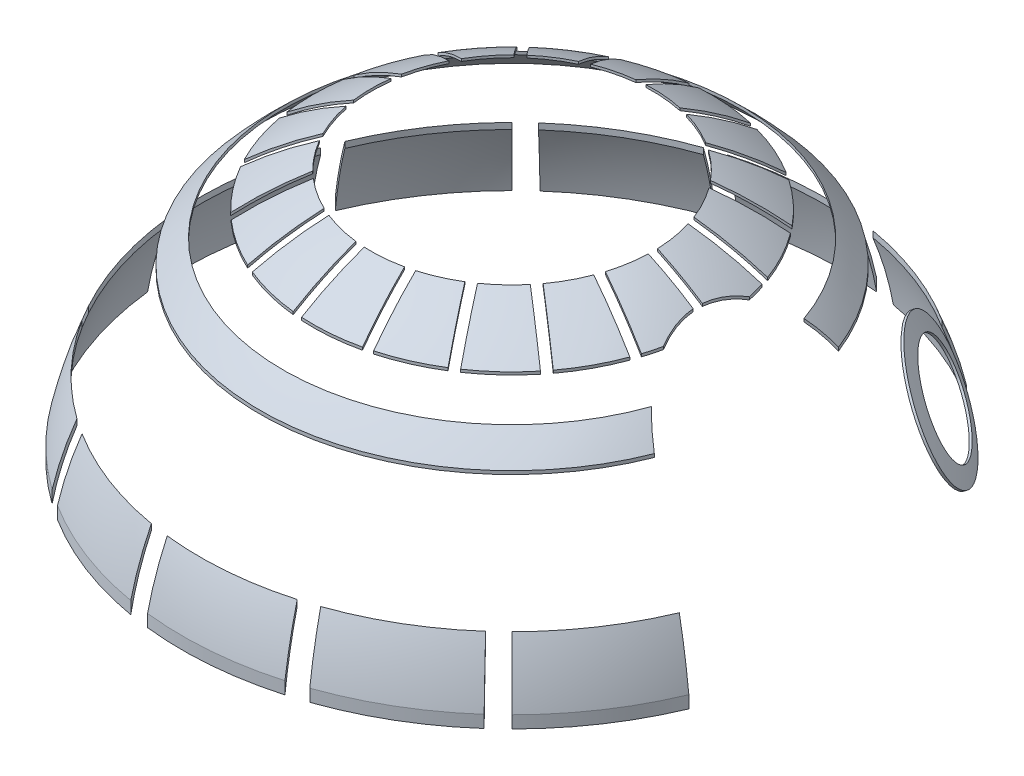
from build123d import *

# Parameters (mm, degrees)
SHELL_1_T           = 0.5
SKETCH_2_OUTSIDE_W  = 198.3
SKETCH_2_OUTSIDE_H  = 198.3
CUT_EXTRUDE_1_DEPTH = 255
SKETCH_4_R          = 15
SKETCH_4_R_2        = 11
CUT_EXTRUDE_2_DEPTH = 20


with BuildPart() as part:
    # 草图1 → 旋转1 (revolve)
    with BuildSketch(Plane.XY):
        with BuildLine():
            Line((-75, 129.232052778), (0, 129.232052778))
            Line((0, 129.232052778), (0, 204.232052778))
            ThreePointArc((0, 204.232052778), (-53.033008589, 182.265061367), (-75, 129.232052778))
        make_face()
    revolve(axis=Axis((0, 0, 0), (0, 1, 0)))

    # 抽壳1
    shell_1_openings = [part.faces().sort_by_distance(p)[0] for p in [
        (0, 129.232052778, 0),
    ]]
    offset(amount=SHELL_1_T, openings=shell_1_openings, kind=Kind.INTERSECTION)

    # 草图2 outside → 切除-拉伸1 (cut)
    with BuildSketch(Plane(origin=(0, 0, 0), x_dir=(1, 0, 0), z_dir=(0, 1, 0))):
        Rectangle(SKETCH_2_OUTSIDE_W, SKETCH_2_OUTSIDE_H)
        with BuildLine():
            Line((64.567988979, -27.036545622), (68.257588349, -28.581491086))
            ThreePointArc((68.257588349, -28.581491086), (61.44952225, -41.230525285), (52.325901808, -52.325901808))
            Line((52.325901808, -52.325901808), (49.497474683, -49.497474683))
            ThreePointArc((49.497474683, -49.497474683), (58.127926453, -39.001848242), (64.567988979, -27.036545622))
        make_face(mode=Mode.SUBTRACT)
        with BuildLine():
            Line((23.561083333, -37.940390341), (16.433673676, -27.031077726))
            ThreePointArc((16.433673676, -27.031077726), (12.707454249, -28.970077667), (8.757185879, -30.398297469))
            Line((8.757185879, -30.398297469), (11.956164806, -43.030779568))
            ThreePointArc((11.956164806, -43.030779568), (17.940087638, -40.899280221), (23.561083333, -37.940390341))
        make_face(mode=Mode.SUBTRACT)
        with BuildLine():
            Line((34.603703454, -28.23440409), (24.320228497, -20.230454256))
            ThreePointArc((24.320228497, -20.230454256), (21.425498168, -23.274295302), (18.153008447, -25.907780258))
            Line((18.153008447, -25.907780258), (25.280418103, -36.817092873))
            ThreePointArc((25.280418103, -36.817092873), (30.248018784, -32.858107473), (34.603703454, -28.23440409))
        make_face(mode=Mode.SUBTRACT)
        with BuildLine():
            Line((25.581670875, -18.609753055), (35.865145833, -26.613702889))
            ThreePointArc((35.865145833, -26.613702889), (39.278107749, -21.256248934), (41.896475375, -15.468782053))
            Line((41.896475375, -15.468782053), (29.571309193, -11.237547158))
            ThreePointArc((29.571309193, -11.237547158), (27.82175691, -15.056381902), (25.581670875, -18.609753055))
        make_face(mode=Mode.SUBTRACT)
        with BuildLine():
            Line((-30.995520467, -32.153935654), (-22.169705549, -22.566544916))
            ThreePointArc((-22.169705549, -22.566544916), (-24.964105398, -19.430343157), (-27.318355609, -15.951559183))
            Line((-27.318355609, -15.951559183), (-38.778984215, -22.153741226))
            ThreePointArc((-38.778984215, -22.153741226), (-35.24374197, -27.431305456), (-30.995520467, -32.153935654))
        make_face(mode=Mode.SUBTRACT)
        with BuildLine():
            Line((-18.875731834, -40.475975773), (-13.641144595, -28.542318891))
            ThreePointArc((-13.641144595, -28.542318891), (-17.3024592, -26.483385342), (-20.65870895, -23.957515273))
            Line((-20.65870895, -23.957515273), (-29.484523869, -33.544906011))
            ThreePointArc((-29.484523869, -33.544906011), (-24.427208496, -37.388625973), (-18.875731834, -40.475975773))
        make_face(mode=Mode.SUBTRACT)
        with BuildLine():
            Line((9.965254244, -43.534946594), (6.766275318, -30.902464495))
            ThreePointArc((6.766275318, -30.902464495), (2.612360485, -31.526502601), (-1.587613659, -31.594687471))
            Line((-1.587613659, -31.594687471), (-2.663724467, -44.581413605))
            ThreePointArc((-2.663724467, -44.581413605), (3.688069627, -44.50838134), (9.965254244, -43.534946594))
        make_face(mode=Mode.SUBTRACT)
        with BuildLine():
            Line((-11.760370624, -29.367302844), (-16.994957862, -41.300959726))
            ThreePointArc((-16.994957862, -41.300959726), (-10.963607955, -43.294308722), (-4.710464769, -44.411815868))
            Line((-4.710464769, -44.411815868), (-3.634353961, -31.425089735))
            ThreePointArc((-3.634353961, -31.425089735), (-7.765823072, -30.666541793), (-11.760370624, -29.367302844))
        make_face(mode=Mode.SUBTRACT)
        with BuildLine():
            Line((-38.778984215, 22.153741226), (-27.318355609, 15.951559183))
            ThreePointArc((-27.318355609, 15.951559183), (-24.964105398, 19.430343157), (-22.169705549, 22.566544916))
            Line((-22.169705549, 22.566544916), (-30.995520467, 32.153935654))
            ThreePointArc((-30.995520467, 32.153935654), (-35.24374197, 27.431305456), (-38.778984215, 22.153741226))
        make_face(mode=Mode.SUBTRACT)
        with BuildLine():
            Line((-43.871139903, 8.361874829), (-31.01763455, 6.217004141))
            ThreePointArc((-31.01763455, 6.217004141), (-29.920503419, 10.271721798), (-28.295834907, 14.145335643))
            Line((-28.295834907, 14.145335643), (-39.756463513, 20.347517686))
            ThreePointArc((-39.756463513, 20.347517686), (-42.241069139, 14.501377352), (-43.871139903, 8.361874829))
        make_face(mode=Mode.SUBTRACT)
        with BuildLine():
            Line((-39.756463513, -20.347517686), (-28.295834907, -14.145335643))
            ThreePointArc((-28.295834907, -14.145335643), (-29.920503419, -10.271721798), (-31.01763455, -6.217004141))
            Line((-31.01763455, -6.217004141), (-43.871139903, -8.361874829))
            ThreePointArc((-43.871139903, -8.361874829), (-42.241069139, -14.501377352), (-39.756463513, -20.347517686))
        make_face(mode=Mode.SUBTRACT)
        with BuildLine():
            Line((-31.355671499, 4.191259766), (-44.209176852, 6.336130453))
            ThreePointArc((-44.209176852, 6.336130453), (-44.660921028, 0), (-44.209176852, -6.336130453))
            Line((-44.209176852, -6.336130453), (-31.355671499, -4.191259766))
            ThreePointArc((-31.355671499, -4.191259766), (-31.63455063, 0), (-31.355671499, 4.191259766))
        make_face(mode=Mode.SUBTRACT)
        with BuildLine():
            Line((11.956164806, 43.030779568), (8.757185879, 30.398297469))
            ThreePointArc((8.757185879, 30.398297469), (12.707454249, 28.970077667), (16.433673676, 27.031077726))
            Line((16.433673676, 27.031077726), (23.561083333, 37.940390341))
            ThreePointArc((23.561083333, 37.940390341), (17.940087638, 40.899280221), (11.956164806, 43.030779568))
        make_face(mode=Mode.SUBTRACT)
        with BuildLine():
            Line((-2.663724467, 44.581413605), (-1.587613659, 31.594687471))
            ThreePointArc((-1.587613659, 31.594687471), (2.612360485, 31.526502601), (6.766275318, 30.902464495))
            Line((6.766275318, 30.902464495), (9.965254244, 43.534946594))
            ThreePointArc((9.965254244, 43.534946594), (3.688069627, 44.50838134), (-2.663724467, 44.581413605))
        make_face(mode=Mode.SUBTRACT)
        with BuildLine():
            Line((-29.484523869, 33.544906011), (-20.65870895, 23.957515273))
            ThreePointArc((-20.65870895, 23.957515273), (-17.3024592, 26.483385342), (-13.641144595, 28.542318891))
            Line((-13.641144595, 28.542318891), (-18.875731834, 40.475975773))
            ThreePointArc((-18.875731834, 40.475975773), (-24.427208496, 37.388625973), (-29.484523869, 33.544906011))
        make_face(mode=Mode.SUBTRACT)
        with BuildLine():
            Line((-3.634353961, 31.425089735), (-4.710464769, 44.411815868))
            ThreePointArc((-4.710464769, 44.411815868), (-10.963607955, 43.294308722), (-16.994957862, 41.300959726))
            Line((-16.994957862, 41.300959726), (-11.760370624, 29.367302844))
            ThreePointArc((-11.760370624, 29.367302844), (-7.765823072, 30.666541793), (-3.634353961, 31.425089735))
        make_face(mode=Mode.SUBTRACT)
        with BuildLine():
            Line((25.280418103, 36.817092873), (18.153008447, 25.907780258))
            ThreePointArc((18.153008447, 25.907780258), (21.425498168, 23.274295302), (24.320228497, 20.230454256))
            Line((24.320228497, 20.230454256), (34.603703454, 28.23440409))
            ThreePointArc((34.603703454, 28.23440409), (30.248018784, 32.858107473), (25.280418103, 36.817092873))
        make_face(mode=Mode.SUBTRACT)
        with BuildLine():
            Line((29.571309193, 11.237547158), (41.896475375, 15.468782053))
            ThreePointArc((41.896475375, 15.468782053), (39.278107749, 21.256248934), (35.865145833, 26.613702889))
            Line((35.865145833, 26.613702889), (25.581670875, 18.609753055))
            ThreePointArc((25.581670875, 18.609753055), (27.82175691, 15.056381902), (29.571309193, 11.237547158))
        make_face(mode=Mode.SUBTRACT)
        with BuildLine():
            Line((30.238162324, -9.295070349), (42.563328506, -13.526305243))
            ThreePointArc((42.563328506, -13.526305243), (43.127573978, -11.602164878), (43.604883346, -9.654636993))
            ThreePointArc((43.604883346, -9.654636993), (42.262805024, -5.426028113), (41.688539591, -1.026877458))
            Line((41.688539591, -1.026877458), (31.617879692, -1.026877458))
            ThreePointArc((31.617879692, -1.026877458), (31.203096592, -5.2068759), (30.238162324, -9.295070349))
        make_face(mode=Mode.SUBTRACT)
        with BuildLine():
            Line((31.617879692, 1.026877458), (41.688539591, 1.026877458))
            ThreePointArc((41.688539591, 1.026877458), (42.262805024, 5.426028113), (43.604883346, 9.654636993))
            ThreePointArc((43.604883346, 9.654636993), (43.127573978, 11.602164878), (42.563328506, 13.526305243))
            Line((42.563328506, 13.526305243), (30.238162324, 9.295070349))
            ThreePointArc((30.238162324, 9.295070349), (31.203096592, 5.2068759), (31.617879692, 1.026877458))
        make_face(mode=Mode.SUBTRACT)
        with BuildLine():
            Line((46.443030426, -52.374086387), (49.096917879, -55.366891323))
            ThreePointArc((49.096917879, -55.366891323), (37.474852018, -63.80936817), (24.440650585, -69.847366443))
            Line((24.440650585, -69.847366443), (23.119534337, -66.071833122))
            ThreePointArc((23.119534337, -66.071833122), (35.449184342, -60.360213133), (46.443030426, -52.374086387))
        make_face(mode=Mode.SUBTRACT)
        with BuildLine():
            Line((19.11946011, -67.338297017), (20.212000688, -71.186199703))
            ThreePointArc((20.212000688, -71.186199703), (6.077827746, -73.749983118), (-8.285371232, -73.534703532))
            Line((-8.285371232, -73.534703532), (-7.837513327, -69.559854693))
            ThreePointArc((-7.837513327, -69.559854693), (5.749296516, -69.763497544), (19.11946011, -67.338297017))
        make_face(mode=Mode.SUBTRACT)
        with BuildLine():
            Line((-11.990953765, -68.965332072), (-12.676151123, -72.90620819))
            ThreePointArc((-12.676151123, -72.90620819), (-26.522984852, -69.083509426), (-39.370373662, -62.657590743))
            Line((-39.370373662, -62.657590743), (-37.242245356, -59.270693946))
            ThreePointArc((-37.242245356, -59.270693946), (-25.089309995, -65.349265673), (-11.990953765, -68.965332072))
        make_face(mode=Mode.SUBTRACT)
        with BuildLine():
            Line((-40.726412187, -56.932937306), (-43.053635741, -60.18624801))
            ThreePointArc((-43.053635741, -60.18624801), (-53.870595016, -50.734199438), (-62.657590743, -39.370373662))
            Line((-62.657590743, -39.370373662), (-59.270693946, -37.242245356))
            ThreePointArc((-59.270693946, -37.242245356), (-50.958670961, -47.991810279), (-40.726412187, -56.932937306))
        make_face(mode=Mode.SUBTRACT)
        with BuildLine():
            Line((-61.3955052, -33.624276071), (-64.903819783, -35.545663275))
            ThreePointArc((-64.903819783, -35.545663275), (-70.548473158, -22.336359037), (-73.534703532, -8.285371232))
            Line((-73.534703532, -8.285371232), (-69.559854693, -7.837513327))
            ThreePointArc((-69.559854693, -7.837513327), (-66.735042177, -21.128988279), (-61.3955052, -33.624276071))
        make_face(mode=Mode.SUBTRACT)
        with BuildLine():
            Line((-69.904465441, -3.655914584), (-73.899006323, -3.864823989))
            ThreePointArc((-73.899006323, -3.864823989), (-73.253360971, 10.485471208), (-69.847366443, 24.440650585))
            Line((-69.847366443, 24.440650585), (-66.071833122, 23.119534337))
            ThreePointArc((-66.071833122, 23.119534337), (-69.293719837, 9.91868898), (-69.904465441, -3.655914584))
        make_face(mode=Mode.SUBTRACT)
        with BuildLine():
            Line((-64.567988979, 27.036545622), (-68.257588349, 28.581491086))
            ThreePointArc((-68.257588349, 28.581491086), (-61.44952225, 41.230525285), (-52.325901808, 52.325901808))
            Line((-52.325901808, 52.325901808), (-49.497474683, 49.497474683))
            ThreePointArc((-49.497474683, 49.497474683), (-58.127926453, 39.001848242), (-64.567988979, 27.036545622))
        make_face(mode=Mode.SUBTRACT)
        with BuildLine():
            Line((-46.443030426, 52.374086387), (-49.096917879, 55.366891323))
            ThreePointArc((-49.096917879, 55.366891323), (-37.474852018, 63.80936817), (-24.440650585, 69.847366443))
            Line((-24.440650585, 69.847366443), (-23.119534337, 66.071833122))
            ThreePointArc((-23.119534337, 66.071833122), (-35.449184342, 60.360213133), (-46.443030426, 52.374086387))
        make_face(mode=Mode.SUBTRACT)
        with BuildLine():
            Line((-19.11946011, 67.338297017), (-20.212000688, 71.186199703))
            ThreePointArc((-20.212000688, 71.186199703), (-6.077827746, 73.749983118), (8.285371232, 73.534703532))
            Line((8.285371232, 73.534703532), (7.837513327, 69.559854693))
            ThreePointArc((7.837513327, 69.559854693), (-5.749296516, 69.763497544), (-19.11946011, 67.338297017))
        make_face(mode=Mode.SUBTRACT)
        with BuildLine():
            Line((11.990953765, 68.965332072), (12.676151123, 72.90620819))
            ThreePointArc((12.676151123, 72.90620819), (26.522984852, 69.083509426), (39.370373662, 62.657590743))
            Line((39.370373662, 62.657590743), (37.242245356, 59.270693946))
            ThreePointArc((37.242245356, 59.270693946), (25.089309995, 65.349265673), (11.990953765, 68.965332072))
        make_face(mode=Mode.SUBTRACT)
        Polygon((36.307091523, 53.036028144), (53.54474529, 70.273681911), (77.689029414, 36.817092873), (59.180573, 26.613702889), align=None, mode=Mode.SUBTRACT)
        with BuildLine():
            ThreePointArc((48.42853851, 17.107647086), (-51.361414808, 0), (48.42853851, -17.107647086))
            ThreePointArc((48.42853851, -17.107647086), (50.417327859, -19.009474003), (52.602908082, -20.68143925))
            ThreePointArc((52.602908082, -20.68143925), (-56.522454548, 0), (52.602908082, 20.68143925))
            ThreePointArc((52.602908082, 20.68143925), (50.417327859, 19.009474003), (48.42853851, 17.107647086))
        make_face(mode=Mode.SUBTRACT)
    extrude(amount=CUT_EXTRUDE_1_DEPTH, mode=Mode.SUBTRACT)

    # 草图4 → 切除-拉伸2 (cut)
    # profile 1 of 2: a face of its own
    with BuildSketch(Plane(origin=(92.049608502, 49.643764162, -76.505791025), x_dir=(0.5501906203809885, 0.22087565281375787, 0.805297601659709), z_dir=(-0.7103733198868201, -0.383115215083289, 0.5904172070363999))):
        Polygon((39.817400951, 72.237429602), (0.441654741, 89.850798338), (13.490049789, 138.241211391), (50.941633837, 126.37536298), align=None)
        with Locations(Location((28.544214022, 115.908737338, 0), (0, 0, 80.870120333))):
            Circle(SKETCH_4_R, mode=Mode.SUBTRACT)
    # profile 2 of 2: a face of its own
    with BuildSketch(Plane(origin=(92.049608502, 49.643764162, -76.505791025), x_dir=(0.5501906203809885, 0.22087565281375787, 0.805297601659709), z_dir=(-0.7103733198868201, -0.383115215083289, 0.5904172070363999))):
        with Locations(Location((28.544214022, 115.908737338, 0), (0, 0, 346.16536823))):
            Circle(SKETCH_4_R_2)
    extrude(amount=CUT_EXTRUDE_2_DEPTH, mode=Mode.SUBTRACT)


solid = part.part
